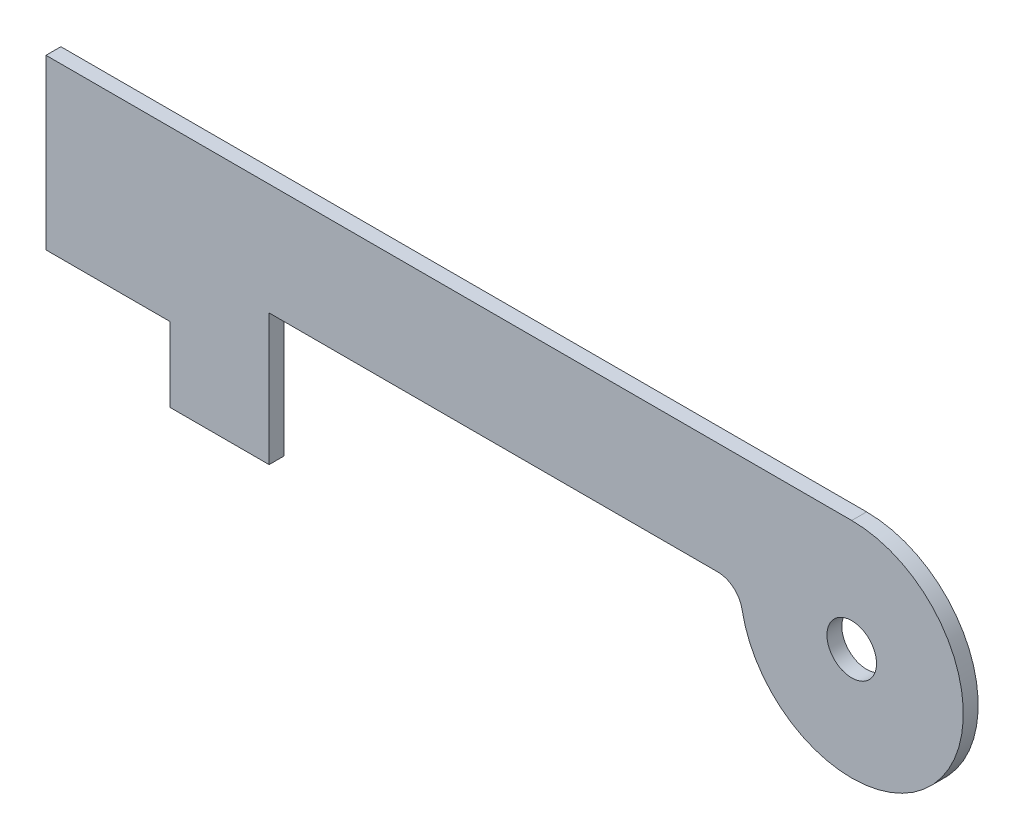
from build123d import *

# Parameters (mm, degrees)
SKETCH1_R           = 2.5
BOSS_EXTRUDE1_DEPTH = 3
BOSS_EXTRUDE2_START = -3
SKETCH3_R           = 22.5
SKETCH3_R_2         = 5
BOSS_EXTRUDE2_DEPTH = 3


with BuildPart() as part:
    # Sketch1 → Boss-Extrude1 (new body)
    # profile 1 of 8: a face of its own
    with BuildSketch(Plane.XY):
        with BuildLine():
            ThreePointArc((22.5, 0), (15.909902577, 15.909902577), (0, 22.5))
            Line((0, 22.5), (-22.5, 0))
            Line((-22.5, 0), (-22.124973736, -4.090909091))
            ThreePointArc((-22.124973736, -4.090909091), (2.054031517, -22.406047276), (22.5, 0))
        make_face()
        with BuildLine():
            ThreePointArc((-7.5, 5), (-9.267766953, 9.267766953), (-5, 7.5))
            Line((-5, 7.5), (-5, 9))
            Line((-5, 9), (-2.405779746, 18.179870439))
            ThreePointArc((-2.405779746, 18.179870439), (0, 20), (2.405779746, 18.179870439))
            Line((2.405779746, 18.179870439), (5, 9))
            Line((5, 9), (5, 7.5))
            ThreePointArc((5, 7.5), (7.5, 10), (10, 7.5))
            ThreePointArc((10, 7.5), (9.267766953, 5.732233047), (7.5, 5))
            Line((7.5, 5), (9, 5))
            Line((9, 5), (18.179870439, 2.405779746))
            ThreePointArc((18.179870439, 2.405779746), (19.493699588, 1.508363998), (20, 0))
            ThreePointArc((20, 0), (19.493699588, -1.508363998), (18.179870439, -2.405779746))
            Line((18.179870439, -2.405779746), (9, -5))
            Line((9, -5), (7.5, -5))
            ThreePointArc((7.5, -5), (9.267766953, -5.732233047), (10, -7.5))
            ThreePointArc((10, -7.5), (7.5, -10), (5, -7.5))
            Line((5, -7.5), (5, -9))
            Line((5, -9), (2.405779746, -18.179870439))
            ThreePointArc((2.405779746, -18.179870439), (0, -20), (-2.405779746, -18.179870439))
            Line((-2.405779746, -18.179870439), (-5, -9))
            Line((-5, -9), (-5, -7.5))
            ThreePointArc((-5, -7.5), (-9.267766953, -9.267766953), (-7.5, -5))
            Line((-7.5, -5), (-9, -5))
            Line((-9, -5), (-18.179870439, -2.405779746))
            ThreePointArc((-18.179870439, -2.405779746), (-20, 0), (-18.179870439, 2.405779746))
            Line((-18.179870439, 2.405779746), (-9, 5))
            Line((-9, 5), (-7.5, 5))
        make_face(mode=Mode.SUBTRACT)
    # profile 2 of 8: a face of its own
    with BuildSketch(Plane.XY):
        with Locations((-7.5, 7.5)):
            Circle(SKETCH1_R)
    # profile 3 of 8: a face of its own
    with BuildSketch(Plane.XY):
        with Locations((7.5, 7.5)):
            Circle(SKETCH1_R)
    # profile 4 of 8: a face of its own
    with BuildSketch(Plane.XY):
        with Locations((7.5, -7.5)):
            Circle(SKETCH1_R)
    # profile 5 of 8: a face of its own
    with BuildSketch(Plane.XY):
        with Locations((-7.5, -7.5)):
            Circle(SKETCH1_R)
    # profile 6 of 8: a face of its own
    with BuildSketch(Plane.XY):
        Polygon((-22.5, 22.5), (0, 22.5), (-22.5, 0), align=None)
    # profile 7 of 8: a face of its own
    with BuildSketch(Plane.XY):
        Polygon((-22.5, 0), (-22.5, 22.5), (-162.5, 22.5), (-162.5, -11.5), (-137.5, -11.5), (-137.5, -26.5), (-117.5, -26.5), (-117.5, 0), align=None)
    # profile 8 of 8: a face of its own
    with BuildSketch(Plane.XY):
        with BuildLine():
            Line((-22.5, 0), (-22.124973736, -4.090909091))
            ThreePointArc((-22.124973736, -4.090909091), (-23.843623821, -1.156469426), (-27.041634566, 0))
            Line((-27.041634566, 0), (-22.5, 0))
        make_face()
    extrude(amount=BOSS_EXTRUDE1_DEPTH)

    # Sketch3 → Boss-Extrude2 (add)
    with BuildSketch(Plane.XY.offset(3).offset(BOSS_EXTRUDE2_START)):
        Circle(SKETCH3_R)
        Circle(SKETCH3_R_2, mode=Mode.SUBTRACT)
    extrude(amount=BOSS_EXTRUDE2_DEPTH)


solid = part.part
